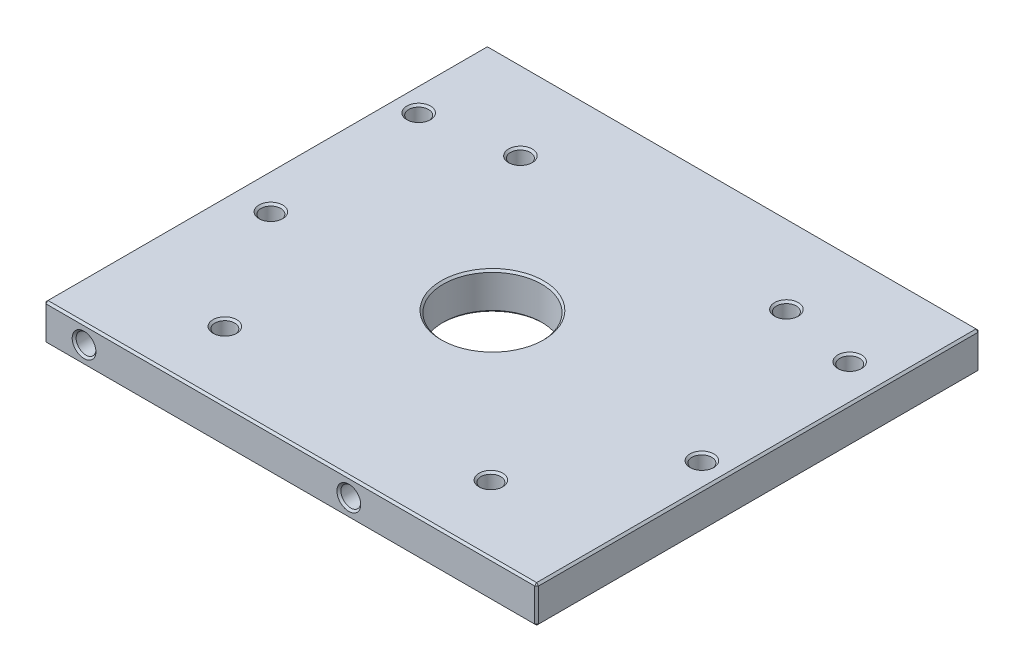
from build123d import *

# Parameters (mm, degrees)
SKETCH1_W                             = 127
SKETCH1_H                             = 114.3
BOSS_EXTRUDE1_DEPTH                   = 9.525
SKETCH2_R                             = 12.7
CUT_EXTRUDE1_DEPTH                    = 86.959863454
F_10_CLEARANCE_HOLE2_D                = 5.1054
F_10_CLEARANCE_HOLE2_DEPTH            = 38.1
F_10_CLEARANCE_HOLE2_TIP              = 1.533816902
F_10_CLEARANCE_HOLE3_D                = 5.1054
TAPPED_HOLE_FOR_10_32_HELICOIL1_D     = 5.1054
TAPPED_HOLE_FOR_10_32_HELICOIL1_DEPTH = 25.4
TAPPED_HOLE_FOR_10_32_HELICOIL1_TIP   = 1.533816902
CHAMFER1_SIZE                         = 0.508


with BuildPart() as part:
    # Sketch1 → Boss-Extrude1 (new body)
    with BuildSketch(Plane(origin=(0, 0, 0), x_dir=(1, 0, 0), z_dir=(0, 1, 0))):
        Rectangle(SKETCH1_W, SKETCH1_H)
    extrude(amount=BOSS_EXTRUDE1_DEPTH)

    # Sketch2 → Cut-Extrude1 (cut, through all)
    with BuildSketch(Plane(origin=(0, 9.525, 0), x_dir=(1, 0, 0), z_dir=(0, 1, 0))):
        with Locations(Location((-3.4925, -1.5494, 0), (0, 0, 270))):
            Circle(SKETCH2_R)
    extrude(amount=-CUT_EXTRUDE1_DEPTH, mode=Mode.SUBTRACT)

    # #10 Clearance Hole2
    with Locations(Plane(origin=(1.014314116, 0, 37.659468055), x_dir=(1, 0, 0), z_dir=(0, -1, 0))):
        with Locations((-35.395754116, -74.210068055), (33.184245884, 1.989931945), (-35.395754116, 1.989931945), (33.184245884, -74.210068055)):
            Hole(F_10_CLEARANCE_HOLE2_D / 2, depth=F_10_CLEARANCE_HOLE2_DEPTH)
            with Locations((0, 0, -(F_10_CLEARANCE_HOLE2_DEPTH + F_10_CLEARANCE_HOLE2_TIP / 2))):  # 118° drill point
                Cone(0, F_10_CLEARANCE_HOLE2_D / 2, F_10_CLEARANCE_HOLE2_TIP, mode=Mode.SUBTRACT)

    # #10 Clearance Hole3 (through all)
    with Locations(Plane(origin=(0, 0, 0), x_dir=(-1, 0, 0), z_dir=(0, -1, 0))):
        with Locations((-54.0385, 33.02), (-57.0865, -8.128), (57.0865, 33.02), (54.0385, -8.128)):
            Hole(F_10_CLEARANCE_HOLE3_D / 2)

    # Tapped Hole for #10-32 Helicoil1
    with Locations(Plane.XY.offset(57.15)):
        with Locations((-53.18125, 4.7625), (15.08125, 4.7625)):
            Hole(TAPPED_HOLE_FOR_10_32_HELICOIL1_D / 2, depth=TAPPED_HOLE_FOR_10_32_HELICOIL1_DEPTH)
            with Locations((0, 0, -(TAPPED_HOLE_FOR_10_32_HELICOIL1_DEPTH + TAPPED_HOLE_FOR_10_32_HELICOIL1_TIP / 2))):  # 118° drill point
                Cone(0, TAPPED_HOLE_FOR_10_32_HELICOIL1_D / 2, TAPPED_HOLE_FOR_10_32_HELICOIL1_TIP, mode=Mode.SUBTRACT)

    # Chamfer1
    chamfer1_edges = [part.edges().sort_by_distance(p)[0] for p in [
        (-63.5, 9.525, 0),
        (0, 9.525, 57.15),
        (-3.4925, 0, -11.1506),
        (-3.4925, 9.525, -11.1506),
        (36.75126, 9.525, -36.5506),
        (36.75126, 0, -36.5506),
        (-31.82874, 9.525, 39.6494),
        (-31.82874, 0, 39.6494),
        (36.75126, 9.525, 39.6494),
        (36.75126, 0, 39.6494),
        (-31.82874, 9.525, -36.5506),
        (-31.82874, 0, -36.5506),
        (63.5, 9.525, 0),
        (-56.5912, 0, 8.128),
        (-56.5912, 9.525, 8.128),
        (0, 0, 57.15),
        (-59.6392, 0, -33.02),
        (-59.6392, 9.525, -33.02),
        (-63.5, 0, 0),
        (0, 0, -57.15),
        (54.5338, 0, 8.128),
        (54.5338, 9.525, 8.128),
        (63.5, 0, 0),
        (51.4858, 0, -33.02),
        (51.4858, 9.525, -33.02),
        (17.63395, 4.7625, 57.15),
        (-50.62855, 4.7625, 57.15),
        (0, 9.525, -57.15),
        (63.5, 4.7625, 57.15),
        (-63.5, 4.7625, 57.15),
        (-63.5, 4.7625, -57.15),
        (63.5, 4.7625, -57.15),
    ]]
    chamfer(chamfer1_edges, length=CHAMFER1_SIZE)


solid = part.part
